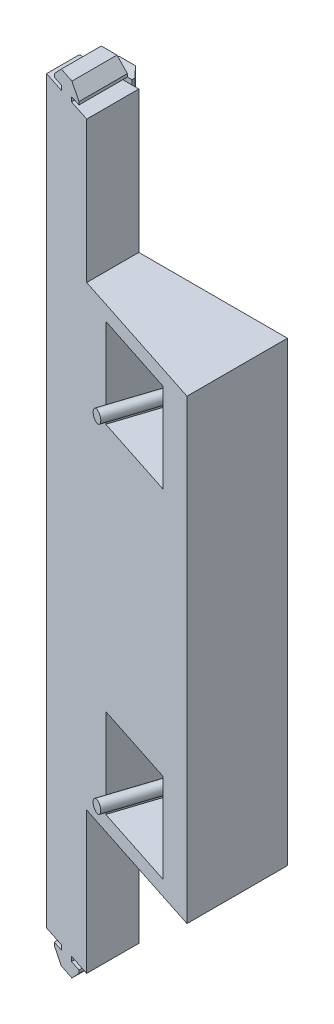
from build123d import *

# Parameters (mm, degrees)
ESQUISSE1_W                   = 70
ESQUISSE1_H                   = 261.4
BOSS_EXTRU_1_DEPTH            = 40
ENL_V_MAT_EXTRU_1_DEPTH       = 335.841640665
ENL_V_MAT_EXTRU_1_DEPTH_BACK  = 40
ENL_V_MAT_EXTRU_2_DEPTH       = 335.841640665
ENL_V_MAT_EXTRU_2_DEPTH_BACK  = 40
ENL_V_MAT_EXTRU_3_DEPTH       = 287.347052656
ENL_V_MAT_EXTRU_3_DEPTH_BACK  = 165
ENL_V_MAT_EXTRU_4_DEPTH       = 328.480443637
ENL_V_MAT_EXTRU_4_DEPTH_BACK  = 261.4
ENL_V_MAT_EXTRU_5_DEPTH       = 328.480443637
ENL_V_MAT_EXTRU_5_DEPTH_BACK  = 261.4
ENL_V_MAT_EXTRU_6_DEPTH       = 335.841640665
ENL_V_MAT_EXTRU_6_DEPTH_BACK  = 40
ENL_V_MAT_EXTRU_8_DEPTH       = 335.841640665
ENL_V_MAT_EXTRU_8_DEPTH_BACK  = 40
ENL_V_MAT_EXTRU_9_DEPTH       = 281.544908808
ENL_V_MAT_EXTRU_9_DEPTH_BACK  = 40
ENL_V_MAT_EXTRU_10_DEPTH      = 335.841640665
ENL_V_MAT_EXTRU_10_DEPTH_BACK = 40
ENL_V_MAT_EXTRU_12_DEPTH      = 335.841640665
ENL_V_MAT_EXTRU_12_DEPTH_BACK = 40
ENL_V_MAT_EXTRU_14_DEPTH      = 280.494983601
ENL_V_MAT_EXTRU_14_DEPTH_BACK = 4.9
ENL_V_MAT_EXTRU_30_DEPTH      = 323.553128903
ENL_V_MAT_EXTRU_30_DEPTH_BACK = 323.553128903
ESQUISSE33_W                  = 30
ESQUISSE33_H                  = 30
ENL_V_MAT_EXTRU_34_DEPTH      = 20
ESQUISSE36_W                  = 30
ESQUISSE36_H                  = 30
ENL_V_MAT_EXTRU_35_DEPTH      = 20
ESQUISSE38_R                  = 2
BOSS_EXTRU_2_DEPTH            = 30
ESQUISSE39_R                  = 2
BOSS_EXTRU_3_DEPTH            = 30


with BuildPart() as part:
    # Esquisse1 → Boss.-Extru.1 (new body)
    with BuildSketch(Plane.XY):
        with Locations((-158.166976901, -139.865044598)):
            Rectangle(ESQUISSE1_W, ESQUISSE1_H)
    extrude(amount=BOSS_EXTRU_1_DEPTH)

    # Esquisse3 → Enlèv. mat.-Extru.1 (cut, two sides: drawn at the far end of the back side and taken through both)
    with BuildSketch(Plane.XY.offset(40).offset(-ENL_V_MAT_EXTRU_1_DEPTH_BACK)):
        Polygon((-173.166976901, 533.112927894), (-173.166976901, -9.165044598), (-173.166976901, -63.005044598), (-123.166976901, -63.005044598), (419.110995591, -63.005044598), (1188.481875045, 701.409795425), (596.203902553, 1297.527767917), align=None)
    extrude(amount=ENL_V_MAT_EXTRU_1_DEPTH + ENL_V_MAT_EXTRU_1_DEPTH_BACK, mode=Mode.SUBTRACT)

    # Esquisse4 → Enlèv. mat.-Extru.2 (cut, two sides: drawn at the far end of the back side and taken through both)
    with BuildSketch(Plane.XY.offset(40).offset(-ENL_V_MAT_EXTRU_2_DEPTH_BACK)):
        Polygon((-173.166976901, -812.84301709), (-173.166976901, -270.565044598), (-173.166976901, -216.725044598), (-123.166976901, -216.725044598), (419.110995591, -216.725044598), (1188.481875045, -981.139884621), (596.203902553, -1577.257857113), align=None)
    extrude(amount=ENL_V_MAT_EXTRU_2_DEPTH + ENL_V_MAT_EXTRU_2_DEPTH_BACK, mode=Mode.SUBTRACT)

    # Esquisse6 → Enlèv. mat.-Extru.3 (cut, two sides: drawn at the far end of the back side and taken through both)
    with BuildSketch(Plane(origin=(0, -63.005044598, 0), x_dir=(1, 0, 0), z_dir=(0, 1, 0)).offset(-ENL_V_MAT_EXTRU_3_DEPTH_BACK)):
        Polygon((42.299289537, -6.2), (-123.166976901, -6.2), (-173.166976901, -6.2), (-173.166976901, 0), (-173.166976901, 165.466266437), (33.046852916, 424.294776666), (248.513119354, 252.628510228), align=None)
    extrude(amount=ENL_V_MAT_EXTRU_3_DEPTH + ENL_V_MAT_EXTRU_3_DEPTH_BACK, mode=Mode.SUBTRACT)

    # Esquisse7 → Enlèv. mat.-Extru.4 (cut, two sides: drawn at the far end of the back side and taken through both)
    with BuildSketch(Plane(origin=(0, -9.165044598, 0), x_dir=(1, 0, 0), z_dir=(0, 1, 0)).offset(-ENL_V_MAT_EXTRU_4_DEPTH_BACK)):
        Polygon((-23.31660268, -6.2), (-173.166976901, -6.2), (-180.716976901, -6.2), (-180.716976901, -4.65), (-177.016976901, -4.65), (-177.016976901, -3.65), (-180.521416942, 0), (-284.304352032, 108.093649388), (-164.080204276, 382.623598415), (96.907545076, 268.329949026), align=None)
    extrude(amount=ENL_V_MAT_EXTRU_4_DEPTH + ENL_V_MAT_EXTRU_4_DEPTH_BACK, mode=Mode.SUBTRACT)

    # Esquisse8 → Enlèv. mat.-Extru.5 (cut, two sides: drawn at the far end of the back side and taken through both)
    with BuildSketch(Plane(origin=(0, -9.165044598, 0), x_dir=(1, 0, 0), z_dir=(0, 1, 0)).offset(-ENL_V_MAT_EXTRU_5_DEPTH_BACK)):
        Polygon((-358.633243338, -6.2), (-193.166976901, -6.2), (-185.616976901, -6.2), (-185.616976901, -4.65), (-189.316976901, -4.65), (-189.316976901, -3.65), (-185.81253686, 0), (-71.214392687, 119.358077569), (-203.692164198, 422.617012095), (-491.11101485, 297.058934527), align=None)
    extrude(amount=ENL_V_MAT_EXTRU_5_DEPTH + ENL_V_MAT_EXTRU_5_DEPTH_BACK, mode=Mode.SUBTRACT)

    # Esquisse9 → Enlèv. mat.-Extru.6 (cut, two sides: drawn at the far end of the back side and taken through both)
    with BuildSketch(Plane.XY.offset(40).offset(-ENL_V_MAT_EXTRU_6_DEPTH_BACK)):
        Polygon((-740.770645722, -15.365044598), (-193.166976901, -15.365044598), (-185.616976901, -15.365044598), (-185.616976901, -13.815044598), (-189.316976901, -13.815044598), (-189.316976901, -12.815044598), (-185.81253686, -9.165044598), (193.445214828, 385.845507022), (-238.735419917, 1392.174981587), (-1172.951280468, 990.964429967), align=None)
    extrude(amount=ENL_V_MAT_EXTRU_6_DEPTH + ENL_V_MAT_EXTRU_6_DEPTH_BACK, mode=Mode.SUBTRACT)

    # Esquisse10 → Enlèv. mat.-Extru.8 (cut, two sides: drawn at the far end of the back side and taken through both)
    with BuildSketch(Plane.XY.offset(40).offset(-ENL_V_MAT_EXTRU_8_DEPTH_BACK)):
        Polygon((372.069388801, -15.365044598), (-173.166976901, -15.365044598), (-180.716976901, -15.365044598), (-180.716976901, -13.815044598), (-177.016976901, -13.815044598), (-177.016976901, -12.815044598), (-180.521416942, -9.165044598), (-558.13962874, 384.13786742), (-127.815363107, 1386.111821344), (802.393654434, 986.608909326), align=None)
    extrude(amount=ENL_V_MAT_EXTRU_8_DEPTH + ENL_V_MAT_EXTRU_8_DEPTH_BACK, mode=Mode.SUBTRACT)

    # Esquisse11 → Enlèv. mat.-Extru.9 (cut, two sides: drawn at the far end of the back side and taken through both)
    with BuildSketch(Plane.ZY.offset(185.616976901).offset(-ENL_V_MAT_EXTRU_9_DEPTH_BACK)):
        Polygon((-537.152349895, -15.365044598), (0, -15.365044598), (6.2, -15.365044598), (6.2, -9.165044598), (6.2, 527.987305297), (-753.448138282, 1287.635443579), (-1296.800488177, 744.283093684), align=None)
    extrude(amount=ENL_V_MAT_EXTRU_9_DEPTH + ENL_V_MAT_EXTRU_9_DEPTH_BACK, mode=Mode.SUBTRACT)

    # Esquisse12 → Enlèv. mat.-Extru.10 (cut, two sides: drawn at the far end of the back side and taken through both)
    with BuildSketch(Plane.XY.offset(40).offset(-ENL_V_MAT_EXTRU_10_DEPTH_BACK)):
        Polygon((372.069388801, -264.365044598), (-173.166976901, -264.365044598), (-180.716976901, -264.365044598), (-180.716976901, -265.915044598), (-177.016976901, -265.915044598), (-177.016976901, -266.915044598), (-180.521416942, -270.565044598), (-558.13962874, -663.867956616), (-127.815363107, -1665.84191054), (802.393654434, -1266.338998522), align=None)
    extrude(amount=ENL_V_MAT_EXTRU_10_DEPTH + ENL_V_MAT_EXTRU_10_DEPTH_BACK, mode=Mode.SUBTRACT)

    # Esquisse13 → Enlèv. mat.-Extru.12 (cut, two sides: drawn at the far end of the back side and taken through both)
    with BuildSketch(Plane.XY.offset(40).offset(-ENL_V_MAT_EXTRU_12_DEPTH_BACK)):
        Polygon((-740.770645722, -264.365044598), (-193.166976901, -264.365044598), (-185.616976901, -264.365044598), (-185.616976901, -265.915044598), (-189.316976901, -265.915044598), (-189.316976901, -266.915044598), (-185.81253686, -270.565044598), (193.445214828, -665.575596218), (-238.735419917, -1671.905070783), (-1172.951280468, -1270.694519163), align=None)
    extrude(amount=ENL_V_MAT_EXTRU_12_DEPTH + ENL_V_MAT_EXTRU_12_DEPTH_BACK, mode=Mode.SUBTRACT)

    # Esquisse16 → Enlèv. mat.-Extru.14 (cut, two sides: drawn at the far end of the back side and taken through both)
    with BuildSketch(Plane(origin=(-180.716976901, 0, 0), x_dir=(0, 0, -1), z_dir=(1, 0, 0)).offset(-ENL_V_MAT_EXTRU_14_DEPTH_BACK)):
        Polygon((537.152349895, -264.365044598), (0, -264.365044598), (-6.2, -264.365044598), (-6.2, -270.565044598), (-6.2, -807.717394493), (753.448138282, -1567.365532776), (1296.800488177, -1024.01318288), align=None)
    extrude(amount=ENL_V_MAT_EXTRU_14_DEPTH + ENL_V_MAT_EXTRU_14_DEPTH_BACK, mode=Mode.SUBTRACT)


with BuildPart() as enl_v_mat_extru_14_kept_piece:
    # of the separate pieces the step leaves, the one the design keeps (enl_v_mat_extru_14_pieces_kept)
    add(part.part.solids().sort_by_distance((-193.166976901, -264.365044598, 6.2))[0])

    # Esquisse32 → Enlèv. mat.-Extru.30 (cut, two sides: drawn at the far end of the back side and taken through both)
    with BuildSketch(Plane(origin=(0, -264.365044598, 0), x_dir=(-1, 0, 0), z_dir=(0, -1, 0)).offset(-ENL_V_MAT_EXTRU_30_DEPTH_BACK)):
        Polygon((364.412131867, -40), (193.166976901, -40), (123.166976901, -40), (193.166976901, -17.255621264), (356.030797415, 35.662041825), (696.438947848, 73.370177768), (704.8202823, -2.291864057), align=None)
    extrude(amount=ENL_V_MAT_EXTRU_30_DEPTH + ENL_V_MAT_EXTRU_30_DEPTH_BACK, mode=Mode.SUBTRACT)

    # Esquisse33 → Enlèv. mat.-Extru.34 (cut)
    with BuildSketch(Plane(origin=(-23.517104767, 0, 72.378206183), x_dir=(0.9510565162951555, 0, 0.3090169943749416), z_dir=(-0.3090169943749416, 0, 0.9510565162951555))):
        with Locations((-132.351187411, -83.005044598)):
            Rectangle(ESQUISSE33_W, ESQUISSE33_H)
    extrude(amount=-ENL_V_MAT_EXTRU_34_DEPTH, mode=Mode.SUBTRACT)

    # Esquisse36 → Enlèv. mat.-Extru.35 (cut)
    with BuildSketch(Plane(origin=(-23.517104767, 0, 72.378206183), x_dir=(0.9510565162951555, 0, 0.3090169943749416), z_dir=(-0.3090169943749416, 0, 0.9510565162951555))):
        with Locations((-132.351187411, -196.725044598)):
            Rectangle(ESQUISSE36_W, ESQUISSE36_H)
    extrude(amount=-ENL_V_MAT_EXTRU_35_DEPTH, mode=Mode.SUBTRACT)

    # Esquisse38 → Boss.-Extru.2 (add)
    with BuildSketch(Plane(origin=(-17.336764879, 0, 53.357075857), x_dir=(0.9510565162951555, 0, 0.3090169943749415), z_dir=(-0.3090169943749415, 0, 0.9510565162951556))):
        with Locations((-132.351187411, -83.005044598)):
            Circle(ESQUISSE38_R)
    extrude(amount=BOSS_EXTRU_2_DEPTH)

    # Esquisse39 → Boss.-Extru.3 (add)
    with BuildSketch(Plane(origin=(-17.336764879, 0, 53.357075857), x_dir=(0.9510565162951555, 0, 0.3090169943749415), z_dir=(-0.3090169943749415, 0, 0.9510565162951556))):
        with Locations((-132.351187411, -196.725044598)):
            Circle(ESQUISSE39_R)
    extrude(amount=BOSS_EXTRU_3_DEPTH)


solid = enl_v_mat_extru_14_kept_piece.part
